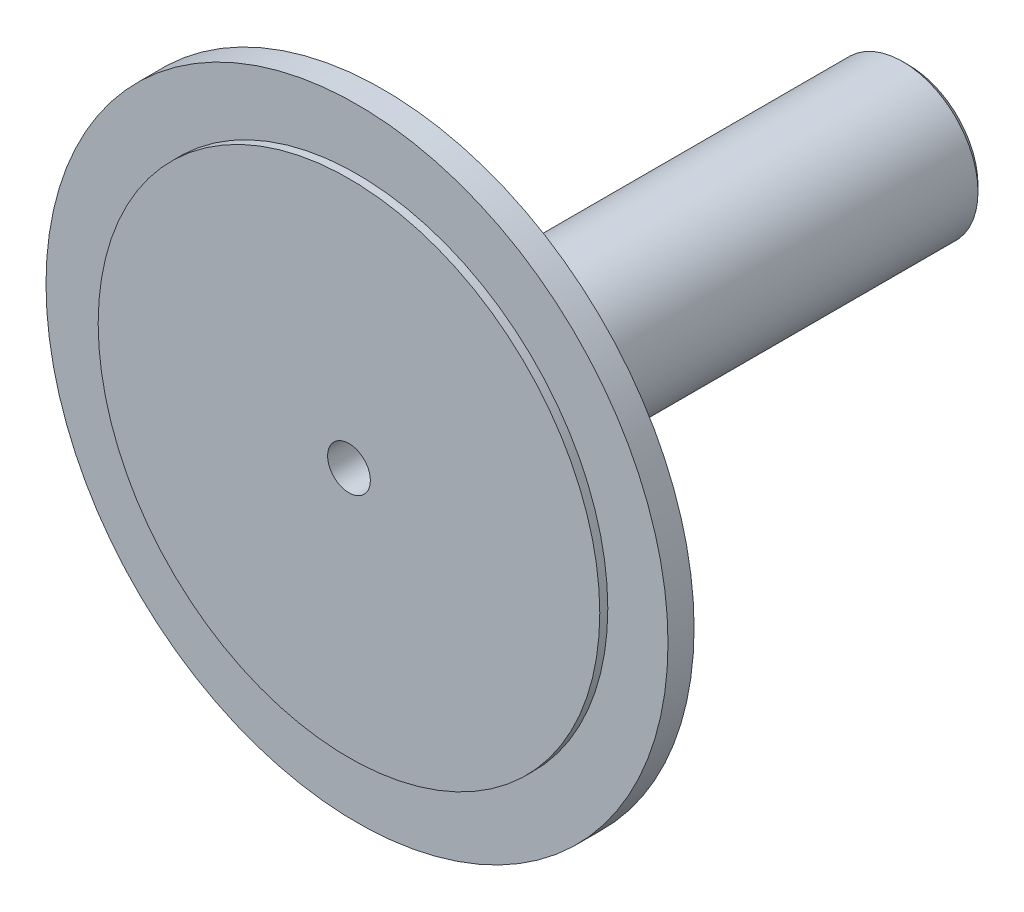
from build123d import *

# Parameters (mm, degrees)
SKETCH1_R                   = 39.37
BASE_EXTRUDE_DEPTH          = 6.35
SKETCH2_R                   = 31.75
BOSS_EXTRUDE1_DEPTH         = 1.016
SKETCH3_R                   = 9.525
BOSS_EXTRUDE2_DEPTH         = 63.5
CHAMFER1_SIZE               = 0.762
F_1_4_28_TAPPED_HOLE1_D     = 5.4102
F_1_4_28_TAPPED_HOLE1_DEPTH = 19.05
CHAMFER2_SIZE               = 3.048
CHAMFER2_SIZE2              = 5.279290861


with BuildPart() as part:
    # Sketch1 → Base-Extrude (new body)
    with BuildSketch(Plane.XY):
        Circle(SKETCH1_R)
    extrude(amount=BASE_EXTRUDE_DEPTH)

    # Sketch2 → Boss-Extrude1 (add)
    with BuildSketch(Plane.XY.offset(6.35)):
        Circle(SKETCH2_R)
    extrude(amount=BOSS_EXTRUDE1_DEPTH)

    # Sketch3 → Boss-Extrude2 (add)
    with BuildSketch(Plane(origin=(0, 0, 0), x_dir=(-1, 0, 0), z_dir=(0, 0, -1))):
        with Locations(Location((0, 0, 0), (0, 0, 180))):
            Circle(SKETCH3_R)
    extrude(amount=BOSS_EXTRUDE2_DEPTH)

    # Chamfer1
    chamfer1_edges = [part.edges().sort_by_distance(p)[0] for p in [
        (-9.525, 0, 0),
        (-9.525, 0, -63.5),
    ]]
    chamfer(chamfer1_edges, length=CHAMFER1_SIZE)

    # 1/4-28 Tapped Hole1
    with Locations(Plane.XY.offset(7.366)):
        with Locations((0, 0)):
            Hole(F_1_4_28_TAPPED_HOLE1_D / 2, depth=F_1_4_28_TAPPED_HOLE1_DEPTH)

    # Chamfer2
    chamfer2_edges = [part.edges().sort_by_distance(p)[0] for p in [
        (-39.37, 0, 0),
    ]]
    chamfer2_side = [part.faces().sort_by_distance(p)[0] for p in [
        (-39.37, 0, 3.175),
    ]]
    chamfer(chamfer2_edges, length=CHAMFER2_SIZE, length2=CHAMFER2_SIZE2, reference=chamfer2_side[0])


solid = part.part
